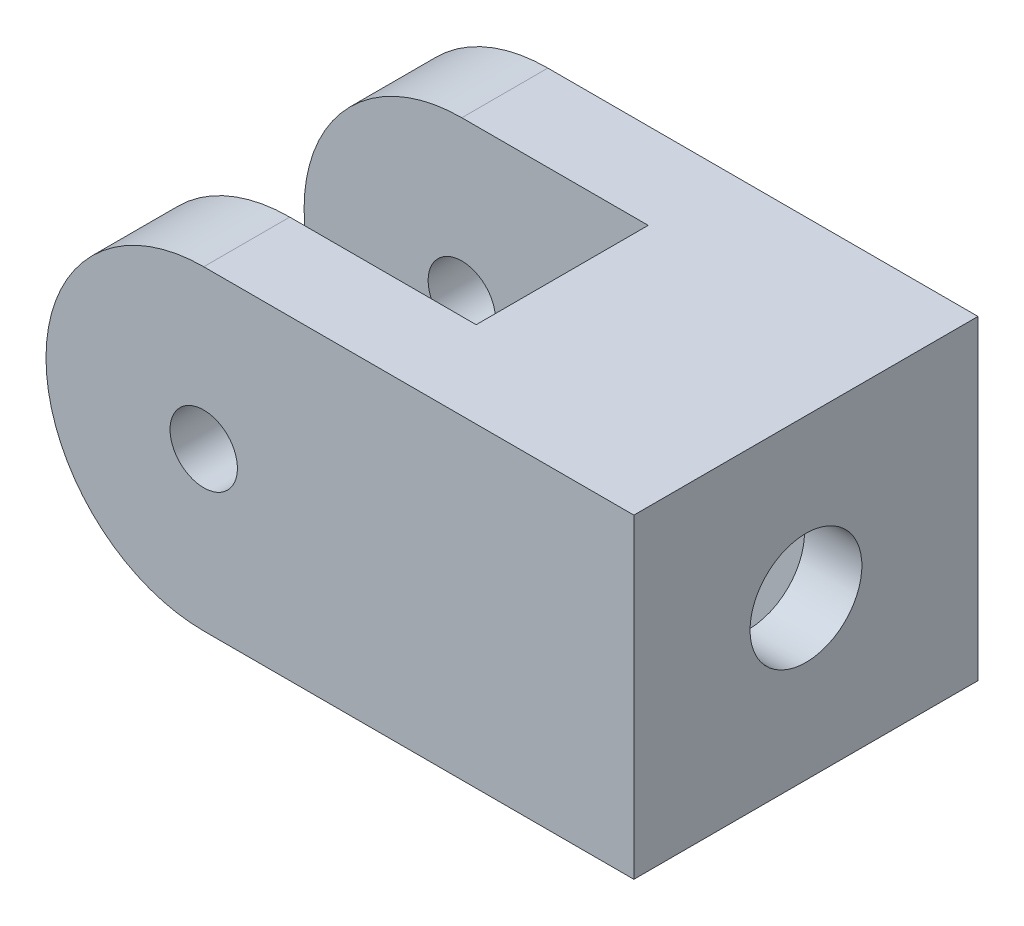
from build123d import *

# Parameters (mm, degrees)
BOSS_EXTRUDE1_DEPTH            = 24
SKETCH2_W                      = 30.110806601
SKETCH2_H                      = 12
CUT_EXTRUDE1_DEPTH             = 45.271887242
CUT_EXTRUDE2_DEPTH             = 6.8
F_7_8_7_8_DIAMETER_HOLE1_D     = 7.8
F_7_8_7_8_DIAMETER_HOLE1_DEPTH = 6.2
F_7_8_7_8_DIAMETER_HOLE2_D     = 7.8
F_4_7_4_7_DIAMETER_HOLE1_D     = 4.7
F_4_7_4_7_DIAMETER_HOLE1_DEPTH = 6
F_4_7_4_7_DIAMETER_HOLE2_D     = 4.7


with BuildPart() as part:
    # Sketch1 → Boss-Extrude1 (new body)
    with BuildSketch(Plane(origin=(0, 0, -24), x_dir=(-1, 0, 0), z_dir=(0, 0, -1))):
        with BuildLine():
            Line((0, 11), (-30, 11))
            Line((-30, 11), (-30, -11))
            Line((-30, -11), (0, -11))
            ThreePointArc((0, -11), (11, 0), (0, 11))
        make_face()
    extrude(amount=-BOSS_EXTRUDE1_DEPTH)

    # Sketch2 → Cut-Extrude1 (cut, through all)
    with BuildSketch(Plane(origin=(0, 11, 0), x_dir=(-1, 0, 0), z_dir=(0, 1, 0))):
        with Locations((2.055403301, -12)):
            Rectangle(SKETCH2_W, SKETCH2_H)
    extrude(amount=-CUT_EXTRUDE1_DEPTH, mode=Mode.SUBTRACT)

    # Sketch3 → Cut-Extrude2 (cut)
    with BuildSketch(Plane(origin=(19.2, 0, 0), x_dir=(0, -1, 0), z_dir=(-1, 0, 0))):
        Polygon((11, -18.5), (11, -5.5), (-3.75277675, -5.5), (-7.505553499, -12), (-3.75277675, -18.5), align=None)
    extrude(amount=-CUT_EXTRUDE2_DEPTH, mode=Mode.SUBTRACT)

    # Ø7.8 (7.8) Diameter Hole1
    with Locations(Plane.ZY.offset(-13)):
        with Locations((-12, 0)):
            Hole(F_7_8_7_8_DIAMETER_HOLE1_D / 2, depth=F_7_8_7_8_DIAMETER_HOLE1_DEPTH)

    # Ø7.8 (7.8) Diameter Hole2 (through all)
    with Locations(Plane.ZY.offset(-26)):
        with Locations((-12, 0)):
            Hole(F_7_8_7_8_DIAMETER_HOLE2_D / 2)

    # Ø4.7 (4.7) Diameter Hole1
    with Locations(Plane(origin=(0, 0, -24), x_dir=(-1, 0, 0), z_dir=(0, 0, -1))):
        with Locations((0, 0)):
            Hole(F_4_7_4_7_DIAMETER_HOLE1_D / 2, depth=F_4_7_4_7_DIAMETER_HOLE1_DEPTH)

    # Ø4.7 (4.7) Diameter Hole2 (through all)
    with Locations(Plane(origin=(0, 0, -6), x_dir=(-1, 0, 0), z_dir=(0, 0, -1))):
        with Locations((0, 0)):
            Hole(F_4_7_4_7_DIAMETER_HOLE2_D / 2)


solid = part.part
